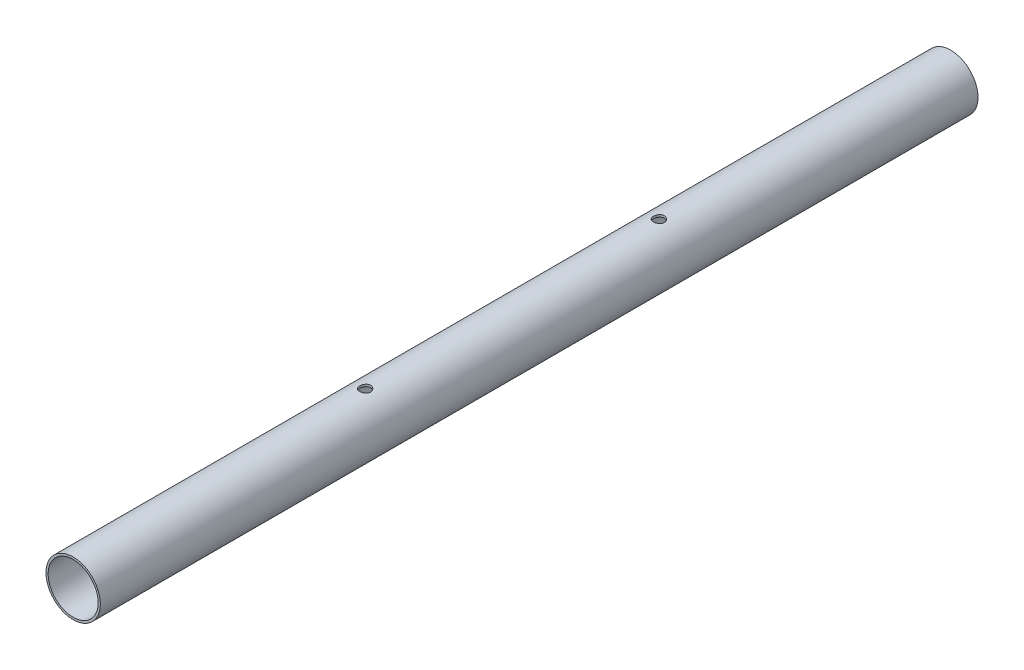
from build123d import *

# Parameters (mm, degrees)
SKETCH_1_R          = 12.5
SKETCH_1_R_2        = 11.5
EXTRUDE_1_DEPTH     = 201.7
SKETCH_3_R          = 2.5
CUT_EXTRUDE_1_DEPTH = 50


with BuildPart() as part:
    # 草图1 → 凸台-拉伸1 (new, symmetric)
    with BuildSketch(Plane.XY):
        Circle(SKETCH_1_R)
        Circle(SKETCH_1_R_2, mode=Mode.SUBTRACT)
    extrude(amount=EXTRUDE_1_DEPTH, both=True)

    # 草图3 → 切除-拉伸1 (cut, symmetric)
    with BuildSketch(Plane(origin=(0, 0, 0), x_dir=(1, 0, 0), z_dir=(0, 1, 0))):
        with Locations(Location((0, 67.5, 0), (0, 0, 270))):
            Circle(SKETCH_3_R)
        with Locations(Location((0, -67.5, 0), (0, 0, 270))):
            Circle(SKETCH_3_R)
    extrude(amount=CUT_EXTRUDE_1_DEPTH, both=True, mode=Mode.SUBTRACT)


solid = part.part
